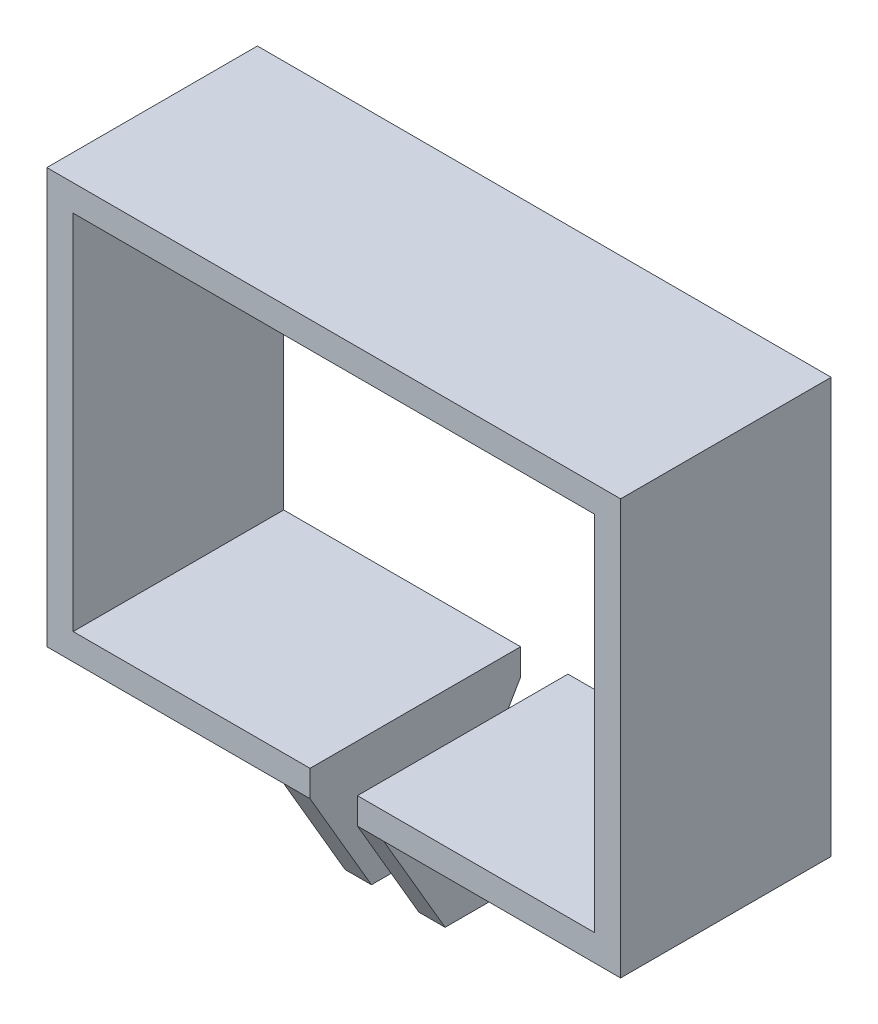
from build123d import *

# Parameters (mm, degrees)
EXTRU_MINCE1_DEPTH      = 24
ESQUISSE2_R             = 2.25
ENL_V_MAT_EXTRU_1_DEPTH = 20


with BuildPart() as part:
    # Esquisse1 → Extru.-Mince1 (new body)
    with BuildSketch(Plane.XY):
        Polygon((-2.7, -35.65), (-2.7, -20.65), (-29.7, -20.65), (-29.7, 20.65), (29.7, 20.65), (29.7, -20.65), (2.7, -20.65), (2.7, -35.65), (5.7, -35.65), (5.7, -23.65), (32.7, -23.65), (32.7, 23.65), (-32.7, 23.65), (-32.7, -23.65), (-5.7, -23.65), (-5.7, -35.65), align=None)
    extrude(amount=EXTRU_MINCE1_DEPTH)

    # Esquisse2 → Enlèv. mat.-Extru.1 (cut)
    with BuildSketch(Plane.ZY.offset(5.7)):
        with Locations(Location((12, -30.65, 0), (0, 0, 270))):
            Circle(ESQUISSE2_R)
        Polygon((0, -23.65), (7, -35.65), (0, -35.65), align=None)
        Polygon((17, -35.65), (24, -35.65), (24, -23.65), align=None)
    extrude(amount=-ENL_V_MAT_EXTRU_1_DEPTH, mode=Mode.SUBTRACT)


solid = part.part
